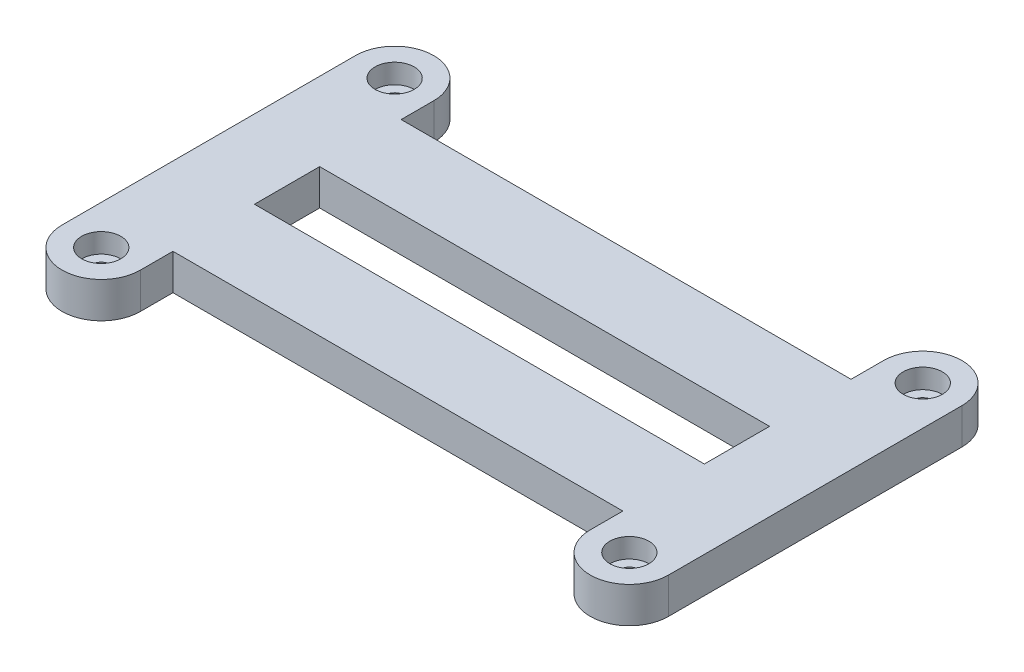
from build123d import *

# Parameters (mm, degrees)
SKETCH_1_R          = 1.5
SKETCH_1_W          = 69
SKETCH_1_H          = 10
EXTRUDE_3_DEPTH     = 5.5
SKETCH_2_R          = 3
CUT_EXTRUDE_1_DEPTH = 3


with BuildPart() as part:
    # 草图1 → 凸台-拉伸3 (new body)
    with BuildSketch(Plane(origin=(0, 0, 0), x_dir=(1, 0, 0), z_dir=(0, 1, 0))):
        with BuildLine():
            Line((46.5, 22.5), (46.5, -22.5))
            ThreePointArc((46.5, -22.5), (40.5, -28.5), (34.5, -22.5))
            Line((34.5, -22.5), (34.5, -17.5))
            Line((34.5, -17.5), (-34.5, -17.5))
            Line((-34.5, -17.5), (-34.5, -22.5))
            ThreePointArc((-34.5, -22.5), (-40.5, -28.5), (-46.5, -22.5))
            Line((-46.5, -22.5), (-46.5, 22.5))
            ThreePointArc((-46.5, 22.5), (-40.5, 28.5), (-34.5, 22.5))
            Line((-34.5, 22.5), (-34.5, 17.5))
            Line((-34.5, 17.5), (34.5, 17.5))
            Line((34.5, 17.5), (34.5, 22.5))
            ThreePointArc((34.5, 22.5), (40.5, 28.5), (46.5, 22.5))
        make_face()
        with Locations(Location((40.5, 22.5, 0), (0, 0, 270))):
            Circle(SKETCH_1_R, mode=Mode.SUBTRACT)
        with Locations(Location((40.5, -22.5, 0), (0, 0, 90))):
            Circle(SKETCH_1_R, mode=Mode.SUBTRACT)
        with Locations(Location((-40.5, -22.5, 0), (0, 0, 270))):
            Circle(SKETCH_1_R, mode=Mode.SUBTRACT)
        with Locations(Location((-40.5, 22.5, 0), (0, 0, 90))):
            Circle(SKETCH_1_R, mode=Mode.SUBTRACT)
        Rectangle(SKETCH_1_W, SKETCH_1_H, mode=Mode.SUBTRACT)
    extrude(amount=EXTRUDE_3_DEPTH)

    # 草图2 → 切除-拉伸1 (cut)
    with BuildSketch(Plane(origin=(0, 5.5, 0), x_dir=(1, 0, 0), z_dir=(0, 1, 0))):
        with Locations(Location((40.5, 22.5, 0), (0, 0, 270))):
            Circle(SKETCH_2_R)
        with Locations(Location((40.5, -22.5, 0), (0, 0, 90))):
            Circle(SKETCH_2_R)
        with Locations(Location((-40.5, -22.5, 0), (0, 0, 270))):
            Circle(SKETCH_2_R)
        with Locations(Location((-40.5, 22.5, 0), (0, 0, 90))):
            Circle(SKETCH_2_R)
    extrude(amount=-CUT_EXTRUDE_1_DEPTH, mode=Mode.SUBTRACT)


solid = part.part
